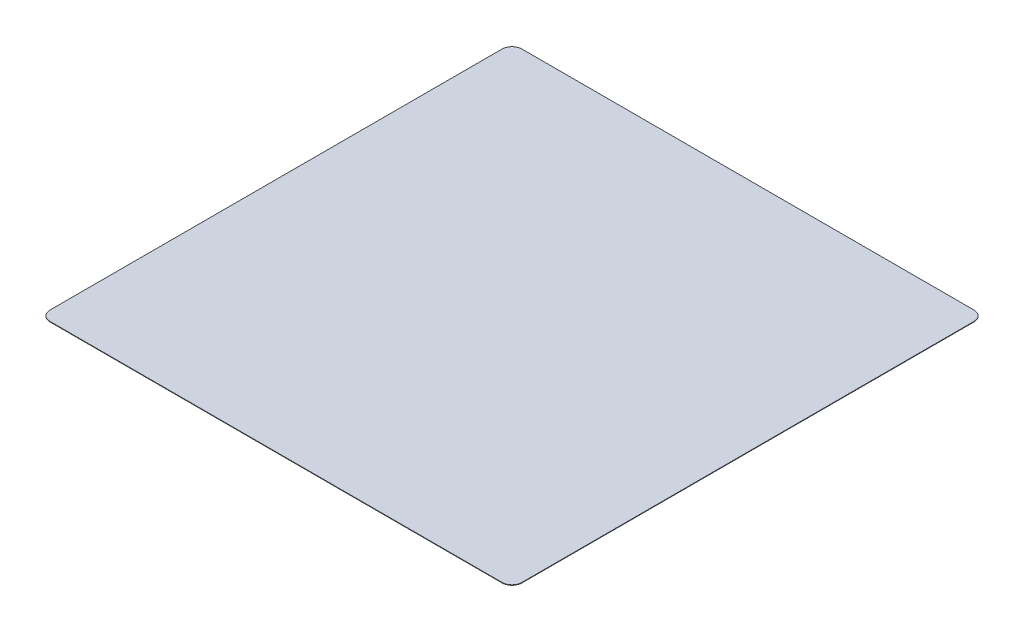
from build123d import *

# Parameters (mm, degrees)
SKETCH1_W           = 94.7
SKETCH1_H           = 94.7
BOSS_EXTRUDE1_DEPTH = 0.1
FILLET1_R           = 2


with BuildPart() as part:
    # Sketch1 → Boss-Extrude1 (new body)
    with BuildSketch(Plane(origin=(0, 0, 0), x_dir=(1, 0, 0), z_dir=(0, 1, 0))):
        Rectangle(SKETCH1_W, SKETCH1_H)
    extrude(amount=BOSS_EXTRUDE1_DEPTH)

    # Fillet1
    fillet1_edges = [part.edges().sort_by_distance(p)[0] for p in [
        (47.35, 0.05, 47.35),
        (-47.35, 0.05, 47.35),
        (-47.35, 0.05, -47.35),
        (47.35, 0.05, -47.35),
    ]]
    fillet(fillet1_edges, radius=FILLET1_R)


solid = part.part
